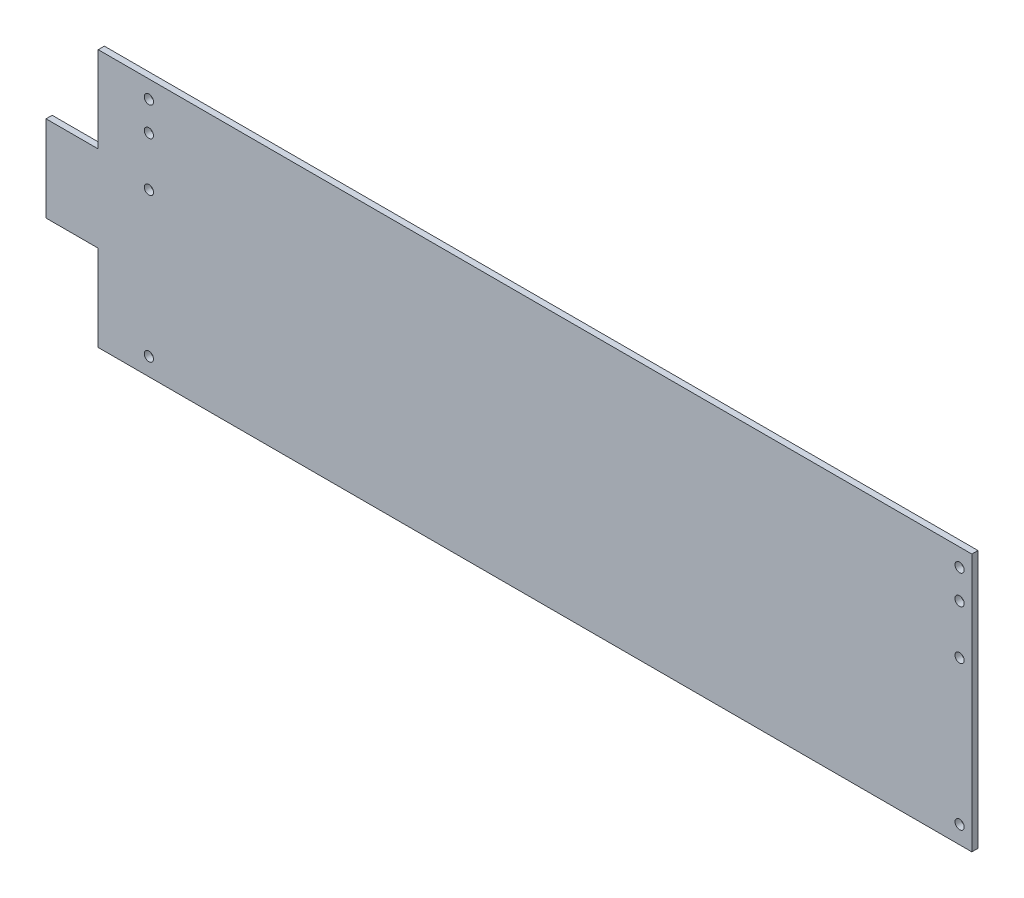
from build123d import *

# Parameters (mm, degrees)
MODEL_W             = 272
MODEL_H             = 84
MODEL_R             = 1.5
MODEL_W_2           = 12.5
MODEL_W_3           = 17
MODEL_H_2           = 28
BOSS_EXTRUDE1_DEPTH = 2


with BuildPart() as part:
    # Model → Boss-Extrude1 (new body)
    # profile 1 of 3: a face of its own
    with BuildSketch(Plane.XY):
        Rectangle(MODEL_W, MODEL_H)
        with Locations((-132, 26.75)):
            Circle(MODEL_R, mode=Mode.SUBTRACT)
        with Locations((-132, -36.25)):
            Circle(MODEL_R, mode=Mode.SUBTRACT)
        with Locations((132, -36.25)):
            Circle(MODEL_R, mode=Mode.SUBTRACT)
        with Locations((132, 10.75)):
            Circle(MODEL_R, mode=Mode.SUBTRACT)
        with Locations((132, 26.75)):
            Circle(MODEL_R, mode=Mode.SUBTRACT)
        with Locations((132, 36.25)):
            Circle(MODEL_R, mode=Mode.SUBTRACT)
        with Locations((-132, 10.75)):
            Circle(MODEL_R, mode=Mode.SUBTRACT)
        with Locations((-132, 36.25)):
            Circle(MODEL_R, mode=Mode.SUBTRACT)
    # profile 2 of 3: a face of its own
    with BuildSketch(Plane.XY):
        with Locations((-142.25, 0)):
            Rectangle(MODEL_W_2, MODEL_H)
    # profile 3 of 3: a face of its own
    with BuildSketch(Plane.XY):
        with Locations((-157, 0)):
            Rectangle(MODEL_W_3, MODEL_H_2)
    extrude(amount=BOSS_EXTRUDE1_DEPTH)


solid = part.part
